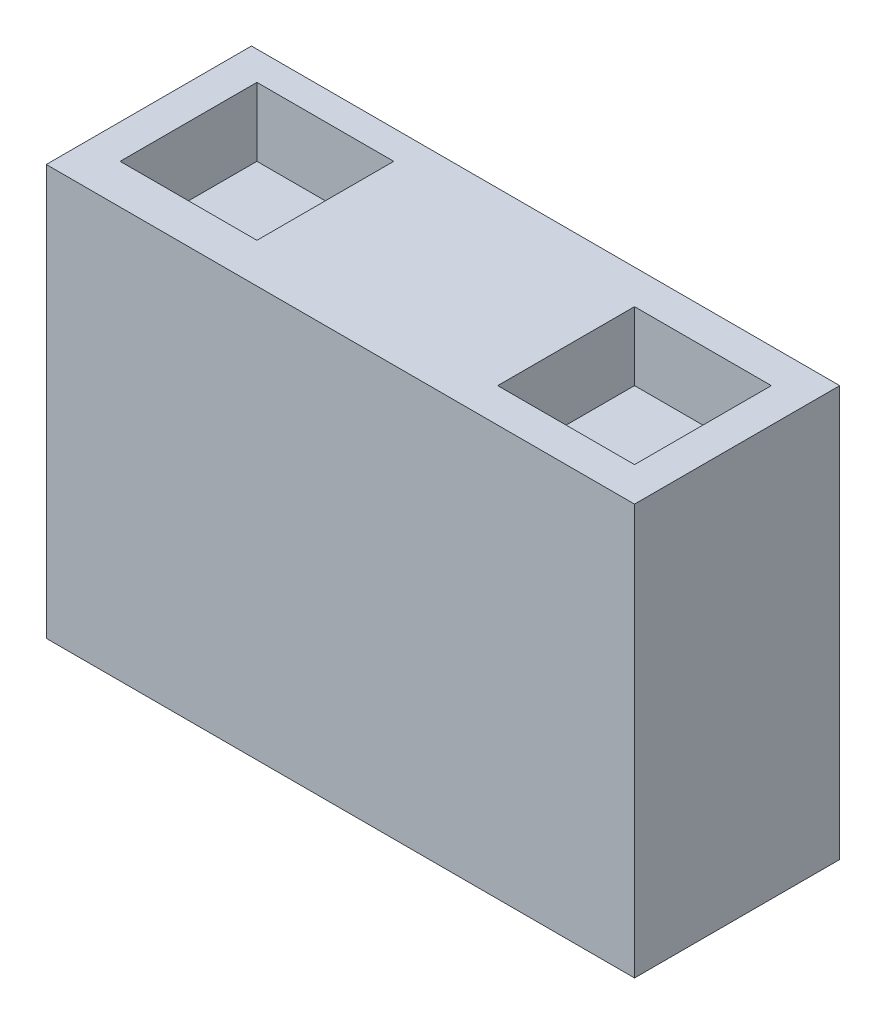
from build123d import *

# Parameters (mm, degrees)
SKETCH1_W           = 43
SKETCH1_H           = 30
BOSS_EXTRUDE1_DEPTH = 15
SKETCH2_W           = 10
SKETCH2_H           = 10
CUT_EXTRUDE1_DEPTH  = 5


with BuildPart() as part:
    # Sketch1 → Boss-Extrude1 (new body)
    with BuildSketch(Plane.XY):
        with Locations((7.231350601, -1.241721854)):
            Rectangle(SKETCH1_W, SKETCH1_H)
    extrude(amount=BOSS_EXTRUDE1_DEPTH)

    # Sketch2 → Cut-Extrude1 (cut)
    with BuildSketch(Plane(origin=(0, 13.758278146, 0), x_dir=(1, 0, 0), z_dir=(0, 1, 0))):
        with Locations((-6.768649399, -7.101659199)):
            Rectangle(SKETCH2_W, SKETCH2_H)
        with Locations((21.231350601, -7.5)):
            Rectangle(SKETCH2_W, SKETCH2_H)
    extrude(amount=-CUT_EXTRUDE1_DEPTH, mode=Mode.SUBTRACT)


solid = part.part
